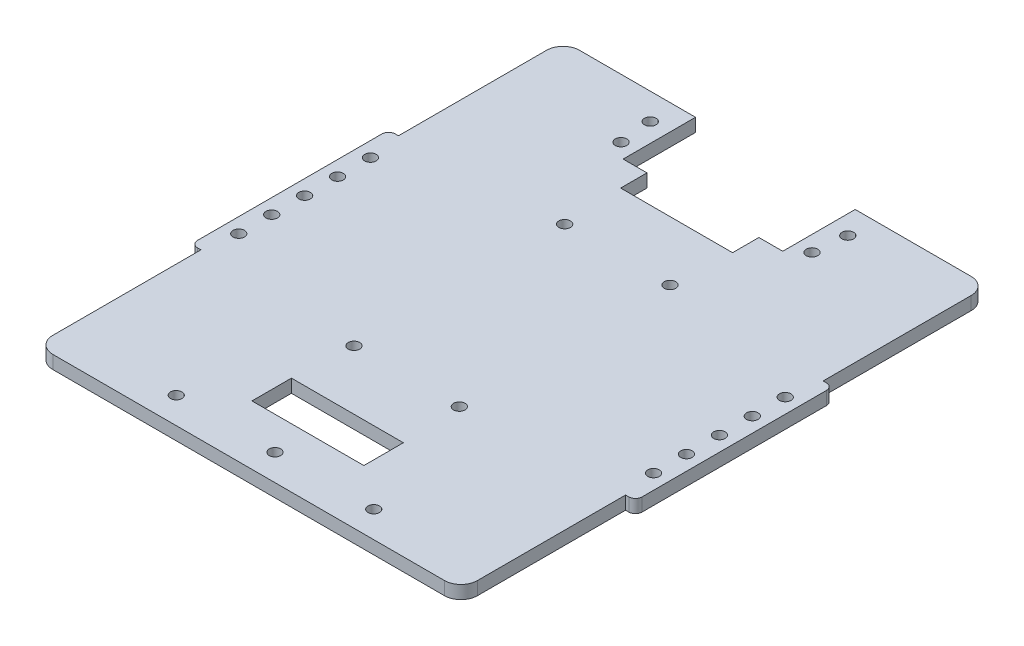
from build123d import *

# Parameters (mm, degrees)
SKETCH_1_W               = 135
SKETCH_1_H               = 100
EXTRUDE_1_DEPTH          = 4
SKETCH_2_W               = 135
SKETCH_2_H               = 4
EXTRUDE_2_DEPTH          = 60
CUT_EXTRUDE_1_DEPTH      = 130.12106722
CUT_EXTRUDE_1_DEPTH_BACK = 130.12106722
SKETCH_3_W               = 3
SKETCH_3_H               = 50
FILLET_1_R               = 5
FILLET_2_R               = 2
CUT_EXTRUDE_2_DEPTH      = 130.12106722
CUT_EXTRUDE_2_DEPTH_BACK = 130.12106722
SKETCH_4_R               = 1.75
CUT_EXTRUDE_3_DEPTH      = 130.12106722
CUT_EXTRUDE_3_DEPTH_BACK = 130.12106722
SKETCH_5_W               = 34
SKETCH_5_H               = 12
CUT_EXTRUDE_4_DEPTH      = 130.12106722
CUT_EXTRUDE_4_DEPTH_BACK = 130.12106722
SKETCH_6_R               = 1.75
SKETCH_7_W               = 48.5
SKETCH_7_H               = 4
CUT_EXTRUDE_5_DEPTH      = 22
CUT_EXTRUDE_6_DEPTH      = 130.12106722
CUT_EXTRUDE_6_DEPTH_BACK = 130.12106722
SKETCH_8_R               = 1.75
CUT_EXTRUDE_7_DEPTH      = 130.12106722
CUT_EXTRUDE_7_DEPTH_BACK = 130.12106722
SKETCH_9_R               = 1.75


with BuildPart() as part:
    # 草图1 → 凸台-拉伸1 (new body)
    with BuildSketch(Plane(origin=(0, 0, 0), x_dir=(1, 0, 0), z_dir=(0, 1, 0))):
        Rectangle(SKETCH_1_W, SKETCH_1_H)
    extrude(amount=EXTRUDE_1_DEPTH)

    # 草图2 → 凸台-拉伸2 (add)
    with BuildSketch(Plane.XY.offset(50)):
        with Locations((0, 2)):
            Rectangle(SKETCH_2_W, SKETCH_2_H)
    extrude(amount=EXTRUDE_2_DEPTH)

    # 草图3 → 切除-拉伸1 (cut, two sides: drawn at the far end of the back side and taken through both)
    with BuildSketch(Plane(origin=(0, 4, 0), x_dir=(1, 0, 0), z_dir=(0, 1, 0)).offset(-CUT_EXTRUDE_1_DEPTH_BACK)):
        with Locations((-66, 25)):
            Rectangle(SKETCH_3_W, SKETCH_3_H)
        with Locations((66, 25)):
            Rectangle(SKETCH_3_W, SKETCH_3_H)
        with Locations((-66, -85)):
            Rectangle(SKETCH_3_W, SKETCH_3_H)
        with Locations((66, -85)):
            Rectangle(SKETCH_3_W, SKETCH_3_H)
    extrude(amount=CUT_EXTRUDE_1_DEPTH + CUT_EXTRUDE_1_DEPTH_BACK, mode=Mode.SUBTRACT)

    # 圆角1
    fillet_1_edges = [part.edges().sort_by_distance(p)[0] for p in [
        (64.5, 2, -50),
        (-64.5, 2, 110),
        (64.5, 2, 110),
        (-64.5, 2, -50),
    ]]
    fillet(fillet_1_edges, radius=FILLET_1_R)

    # 圆角2
    fillet_2_edges = [part.edges().sort_by_distance(p)[0] for p in [
        (67.5, 2, 0),
        (-67.5, 2, 60),
        (67.5, 2, 60),
        (-67.5, 2, 0),
    ]]
    fillet(fillet_2_edges, radius=FILLET_2_R)

    # 草图4 → 切除-拉伸2 (cut, two sides: drawn at the far end of the back side and taken through both)
    with BuildSketch(Plane(origin=(0, 4, 0), x_dir=(1, 0, 0), z_dir=(0, 1, 0)).offset(-CUT_EXTRUDE_2_DEPTH_BACK)):
        with Locations(Location((-30, -102, 0), (0, 0, 270))):
            Circle(SKETCH_4_R)
        with Locations(Location((0, -102, 0), (0, 0, 270))):
            Circle(SKETCH_4_R)
        with Locations(Location((30, -102, 0), (0, 0, 270))):
            Circle(SKETCH_4_R)
        with Locations(Location((-30, 42, 0), (0, 0, 270))):
            Circle(SKETCH_4_R)
        with Locations(Location((0, 42, 0), (0, 0, 270))):
            Circle(SKETCH_4_R)
        with Locations(Location((30, 42, 0), (0, 0, 270))):
            Circle(SKETCH_4_R)
    extrude(amount=CUT_EXTRUDE_2_DEPTH + CUT_EXTRUDE_2_DEPTH_BACK, mode=Mode.SUBTRACT)

    # 草图5 → 切除-拉伸3 (cut, two sides: drawn at the far end of the back side and taken through both)
    with BuildSketch(Plane(origin=(0, 4, 0), x_dir=(1, 0, 0), z_dir=(0, 1, 0)).offset(-CUT_EXTRUDE_3_DEPTH_BACK)):
        with Locations((0, -86)):
            Rectangle(SKETCH_5_W, SKETCH_5_H)
        with Locations((0, 26)):
            Rectangle(SKETCH_5_W, SKETCH_5_H)
    extrude(amount=CUT_EXTRUDE_3_DEPTH + CUT_EXTRUDE_3_DEPTH_BACK, mode=Mode.SUBTRACT)

    # 草图6 → 切除-拉伸4 (cut, two sides: drawn at the far end of the back side and taken through both)
    with BuildSketch(Plane.XZ.offset(-CUT_EXTRUDE_4_DEPTH_BACK)):
        with Locations(Location((-16, -2, 0), (0, 0, 270))):
            Circle(SKETCH_6_R)
        with Locations(Location((16, -2, 0), (0, 0, 270))):
            Circle(SKETCH_6_R)
        with Locations(Location((16, 62, 0), (0, 0, 270))):
            Circle(SKETCH_6_R)
        with Locations(Location((-16, 62, 0), (0, 0, 270))):
            Circle(SKETCH_6_R)
    extrude(amount=CUT_EXTRUDE_4_DEPTH + CUT_EXTRUDE_4_DEPTH_BACK, mode=Mode.SUBTRACT)

    # 草图7 → 切除-拉伸5 (cut)
    with BuildSketch(Plane(origin=(0, 0, -50), x_dir=(-1, 0, 0), z_dir=(0, 0, -1))):
        with Locations((0, 2)):
            Rectangle(SKETCH_7_W, SKETCH_7_H)
    extrude(amount=-CUT_EXTRUDE_5_DEPTH, mode=Mode.SUBTRACT)

    # 草图8 → 切除-拉伸6 (cut, two sides: drawn at the far end of the back side and taken through both)
    with BuildSketch(Plane.XZ.offset(-CUT_EXTRUDE_6_DEPTH_BACK)):
        with Locations(Location((-29, -32.13, 0), (0, 0, 270))):
            Circle(SKETCH_8_R)
        with Locations(Location((29, -32.13, 0), (0, 0, 270))):
            Circle(SKETCH_8_R)
    extrude(amount=CUT_EXTRUDE_6_DEPTH + CUT_EXTRUDE_6_DEPTH_BACK, mode=Mode.SUBTRACT)

    # 草图9 → 切除-拉伸7 (cut, two sides: drawn at the far end of the back side and taken through both)
    with BuildSketch(Plane(origin=(0, 4, 0), x_dir=(1, 0, 0), z_dir=(0, 1, 0)).offset(-CUT_EXTRUDE_7_DEPTH_BACK)):
        with Locations(Location((-63, -30, 0), (0, 0, 270))):
            Circle(SKETCH_9_R)
        with Locations(Location((-63, -20, 0), (0, 0, 270))):
            Circle(SKETCH_9_R)
        with Locations(Location((-63, -10, 0), (0, 0, 270))):
            Circle(SKETCH_9_R)
        with Locations(Location((-63, -40, 0), (0, 0, 270))):
            Circle(SKETCH_9_R)
        with Locations(Location((-63, -50, 0), (0, 0, 270))):
            Circle(SKETCH_9_R)
        with Locations(Location((63, -50, 0), (0, 0, 270))):
            Circle(SKETCH_9_R)
        with Locations(Location((63, -40, 0), (0, 0, 270))):
            Circle(SKETCH_9_R)
        with Locations(Location((63, -30, 0), (0, 0, 270))):
            Circle(SKETCH_9_R)
        with Locations(Location((63, -20, 0), (0, 0, 270))):
            Circle(SKETCH_9_R)
        with Locations(Location((63, -10, 0), (0, 0, 270))):
            Circle(SKETCH_9_R)
    extrude(amount=CUT_EXTRUDE_7_DEPTH + CUT_EXTRUDE_7_DEPTH_BACK, mode=Mode.SUBTRACT)


solid = part.part
